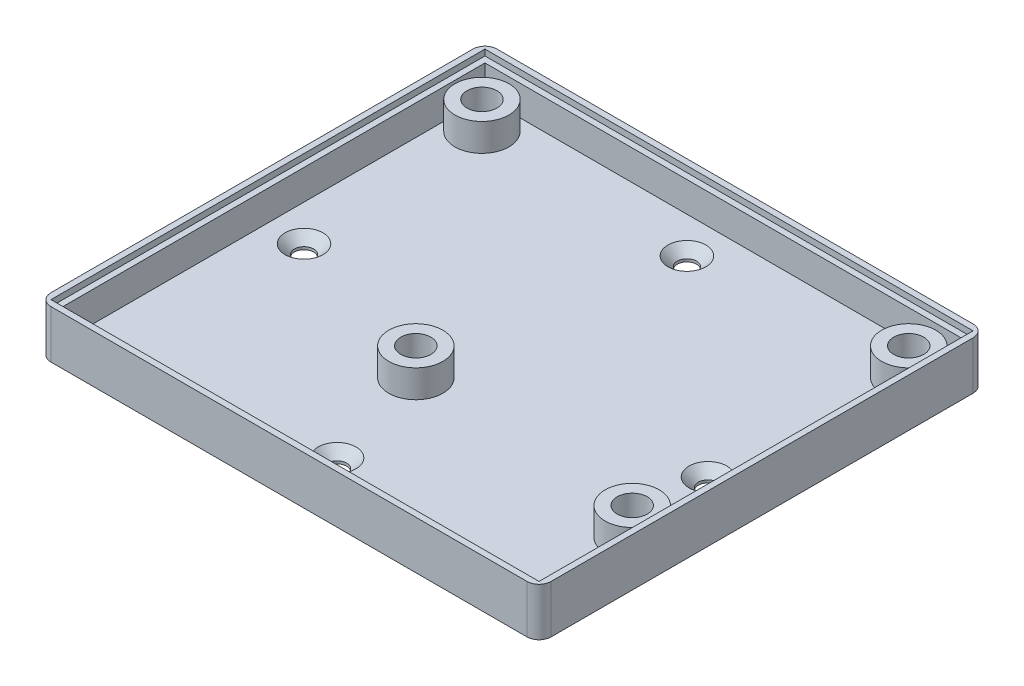
from build123d import *

# Parameters (mm, degrees)
SKETCH1_W                                      = 83.2
SKETCH1_H                                      = 74.2
BOSS_EXTRUDE1_DEPTH                            = 8
SHELL1_T                                       = -2
SKETCH2_R                                      = 4.5
SKETCH2_R_2                                    = 2.5
BOSS_EXTRUDE2_DEPTH                            = 4.6
SKETCH3_W                                      = 81.2
SKETCH3_H                                      = 72.2
CUT_EXTRUDE1_DEPTH                             = 1
SKETCH4_R                                      = 2.5
BOSS_EXTRUDE3_DEPTH                            = 0.5
CSK_FOR_M3_FLAT_HEAD_MACHINE_SCREW1_AT_2_COUNT = 2
CSK_FOR_M3_FLAT_HEAD_MACHINE_SCREW1_AT_2_PITCH = 45.11064176
CSK_FOR_M3_FLAT_HEAD_MACHINE_SCREW1_AT_3_COUNT = 2
CSK_FOR_M3_FLAT_HEAD_MACHINE_SCREW1_AT_3_PITCH = 45.11064176
CSK_FOR_M3_FLAT_HEAD_MACHINE_SCREW1_AT_4_COUNT = 2
CSK_FOR_M3_FLAT_HEAD_MACHINE_SCREW1_AT_4_PITCH = 58.2
FILLET1_R                                      = 2


with BuildPart() as part:
    # Sketch1 → Boss-Extrude1 (new body)
    with BuildSketch(Plane(origin=(0, 0, 0), x_dir=(1, 0, 0), z_dir=(0, 1, 0))):
        with Locations((41.6, 37.1)):
            Rectangle(SKETCH1_W, SKETCH1_H)
    extrude(amount=BOSS_EXTRUDE1_DEPTH)

    # Shell1
    shell1_openings = [part.faces().sort_by_distance(p)[0] for p in [
        (41.6, 8, -37.1),
    ]]
    offset(amount=SHELL1_T, openings=shell1_openings, kind=Kind.INTERSECTION)

    # Sketch2 → Boss-Extrude2 (add)
    # profile 1 of 4: a face of its own
    with BuildSketch(Plane(origin=(0, 2, 0), x_dir=(1, 0, 0), z_dir=(0, 1, 0))):
        with Locations(Location((6.6, 67.1, 0), (0, 0, 90))):
            Circle(SKETCH2_R)
        with Locations(Location((6.6, 67.1, 0), (0, 0, 90))):
            Circle(SKETCH2_R_2, mode=Mode.SUBTRACT)
    # profile 2 of 4: a face of its own
    with BuildSketch(Plane(origin=(0, 2, 0), x_dir=(1, 0, 0), z_dir=(0, 1, 0))):
        with Locations(Location((36.6, 26.1, 0), (0, 0, 90))):
            Circle(SKETCH2_R)
        with Locations(Location((36.6, 26.1, 0), (0, 0, 90))):
            Circle(SKETCH2_R_2, mode=Mode.SUBTRACT)
    # profile 3 of 4: a face of its own
    with BuildSketch(Plane(origin=(0, 2, 0), x_dir=(1, 0, 0), z_dir=(0, 1, 0))):
        with Locations((77.6, 67.1)):
            Circle(SKETCH2_R)
        with Locations(Location((77.6, 67.1, 0), (0, 0, 90))):
            Circle(SKETCH2_R_2, mode=Mode.SUBTRACT)
    # profile 4 of 4: a face of its own
    with BuildSketch(Plane(origin=(0, 2, 0), x_dir=(1, 0, 0), z_dir=(0, 1, 0))):
        with Locations((77.6, 21.1)):
            Circle(SKETCH2_R)
        with Locations(Location((77.6, 21.1, 0), (0, 0, 90))):
            Circle(SKETCH2_R_2, mode=Mode.SUBTRACT)
    extrude(amount=BOSS_EXTRUDE2_DEPTH)

    # Sketch3 → Cut-Extrude1 (cut)
    with BuildSketch(Plane(origin=(0, 8, 0), x_dir=(1, 0, 0), z_dir=(0, 1, 0))):
        with Locations((41.6, 37.1)):
            Rectangle(SKETCH3_W, SKETCH3_H)
    extrude(amount=-CUT_EXTRUDE1_DEPTH, mode=Mode.SUBTRACT)

    # Sketch4 → Boss-Extrude3 (add)
    with BuildSketch(Plane(origin=(0, 2, 0), x_dir=(1, 0, 0), z_dir=(0, 1, 0))):
        with Locations(Location((6.6, 67.1, 0), (0, 0, 90))):
            Circle(SKETCH4_R)
        with Locations(Location((77.6, 67.1, 0), (0, 0, 90))):
            Circle(SKETCH4_R)
        with Locations(Location((36.6, 26.1, 0), (0, 0, 90))):
            Circle(SKETCH4_R)
        with Locations(Location((77.6, 21.1, 0), (0, 0, 90))):
            Circle(SKETCH4_R)
    extrude(amount=BOSS_EXTRUDE3_DEPTH)

    # Sketch6 → CSK for M3 Flat Head Machine Screw1 (revolve, cut)
    with BuildSketch(Plane(origin=(41.6, 2, -66.2), x_dir=(0, 0, 1), z_dir=(1, 0, 0))):
        Polygon((0, 0), (0, 2), (1.6, 2), (1.6, 1.55), (3.15, 0), align=None)
    csk_for_m3_flat_head_machine_screw1 = revolve(axis=Axis((41.6, 8.35, -66.2), (0, -1, 0)), mode=Mode.SUBTRACT)

    # CSK for M3 Flat Head Machine Screw1 at 2: CSK for M3 Flat Head Machine Screw1 ×2
    with Locations(*[Vector(-0.7448353357230582, 0, 0.6672483215852396) * (i * CSK_FOR_M3_FLAT_HEAD_MACHINE_SCREW1_AT_2_PITCH) for i in range(1, CSK_FOR_M3_FLAT_HEAD_MACHINE_SCREW1_AT_2_COUNT)]):
        add(csk_for_m3_flat_head_machine_screw1, mode=Mode.SUBTRACT)

    # CSK for M3 Flat Head Machine Screw1 at 3: CSK for M3 Flat Head Machine Screw1 ×2
    with Locations(*[Vector(0.7448353357230579, 0, 0.6672483215852397) * (i * CSK_FOR_M3_FLAT_HEAD_MACHINE_SCREW1_AT_3_PITCH) for i in range(1, CSK_FOR_M3_FLAT_HEAD_MACHINE_SCREW1_AT_3_COUNT)]):
        add(csk_for_m3_flat_head_machine_screw1, mode=Mode.SUBTRACT)

    # CSK for M3 Flat Head Machine Screw1 at 4: CSK for M3 Flat Head Machine Screw1 ×2
    with Locations(*[(0, 0, i * CSK_FOR_M3_FLAT_HEAD_MACHINE_SCREW1_AT_4_PITCH) for i in range(1, CSK_FOR_M3_FLAT_HEAD_MACHINE_SCREW1_AT_4_COUNT)]):
        add(csk_for_m3_flat_head_machine_screw1, mode=Mode.SUBTRACT)

    # Fillet1
    fillet1_edges = [part.edges().sort_by_distance(p)[0] for p in [
        (0, 4, -74.2),
        (83.2, 4, -74.2),
        (83.2, 4, 0),
        (0, 4, 0),
    ]]
    fillet(fillet1_edges, radius=FILLET1_R)


solid = part.part
